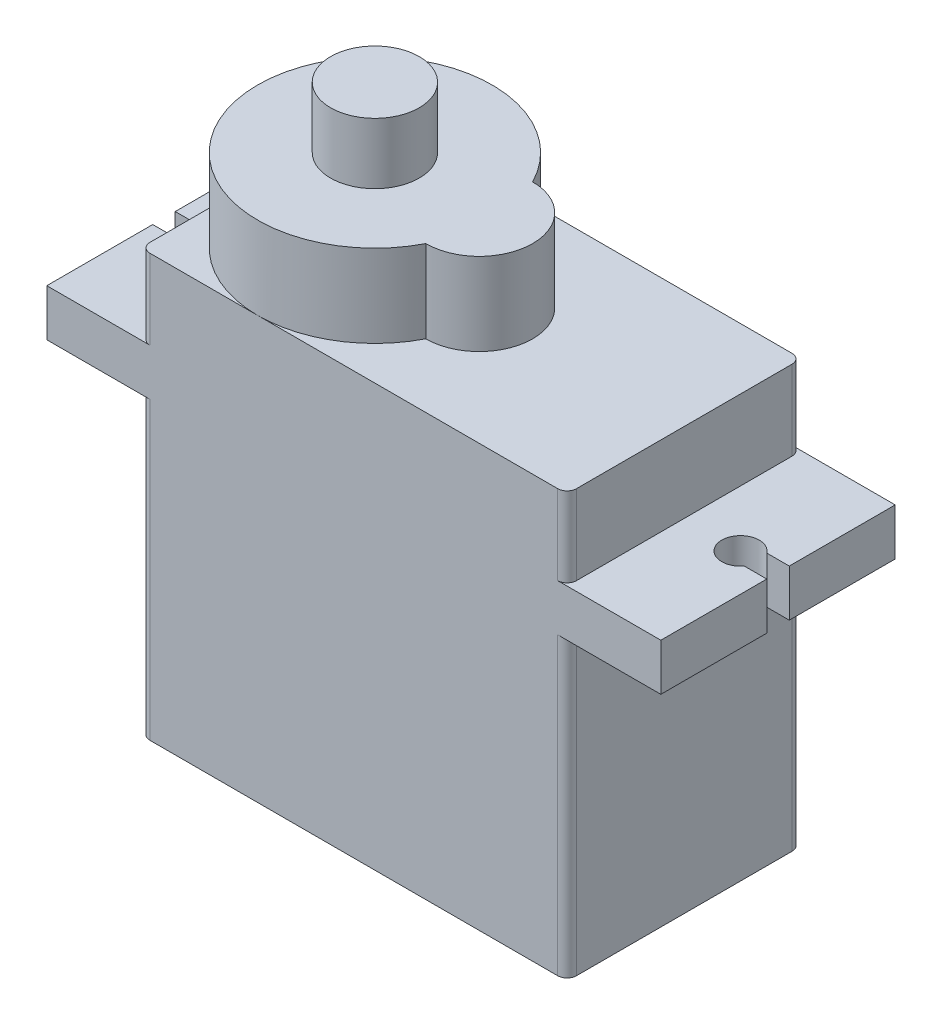
from build123d import *

# Parameters (mm, degrees)
SKETCH1_W           = 22.75
SKETCH1_H           = 12.5
BOSS_EXTRUDE1_DEPTH = 22.5
BOSS_EXTRUDE2_DEPTH = 4.4
SKETCH3_R           = 2.365
BOSS_EXTRUDE3_DEPTH = 3.25
SKETCH4_W           = 12.5
SKETCH4_H           = 2.5
BOSS_EXTRUDE4_DEPTH = 5
SKETCH5_W           = 12.5
SKETCH5_H           = 2.5
BOSS_EXTRUDE5_DEPTH = 5
CUT_EXTRUDE1_DEPTH  = 36.487673916
FILLET1_R           = 0.5


with BuildPart() as part:
    # Sketch1 → Boss-Extrude1 (new body)
    with BuildSketch(Plane(origin=(0, 0, 0), x_dir=(1, 0, 0), z_dir=(0, 1, 0))):
        with Locations((11.375, -6.25)):
            Rectangle(SKETCH1_W, SKETCH1_H)
    extrude(amount=BOSS_EXTRUDE1_DEPTH)

    # Sketch2 → Boss-Extrude2 (add)
    with BuildSketch(Plane(origin=(0, 22.5, 0), x_dir=(1, 0, 0), z_dir=(0, 1, 0))):
        with BuildLine():
            ThreePointArc((11.812373594, -3.4), (0, -6.25), (11.812373594, -9.1))
            ThreePointArc((11.812373594, -9.1), (14.662373594, -6.25), (11.812373594, -3.4))
        make_face()
    extrude(amount=BOSS_EXTRUDE2_DEPTH)

    # Sketch3 → Boss-Extrude3 (add)
    with BuildSketch(Plane(origin=(0, 26.9, 0), x_dir=(1, 0, 0), z_dir=(0, 1, 0))):
        with Locations(Location((6.25, -6.25, 0), (0, 0, 90))):
            Circle(SKETCH3_R)
    extrude(amount=BOSS_EXTRUDE3_DEPTH)

    # Sketch4 → Boss-Extrude4 (add)
    with BuildSketch(Plane(origin=(22.75, 0, 0), x_dir=(0, 0, -1), z_dir=(1, 0, 0))):
        with Locations((-6.25, 17)):
            Rectangle(SKETCH4_W, SKETCH4_H)
    extrude(amount=BOSS_EXTRUDE4_DEPTH)

    # Sketch5 → Boss-Extrude5 (add)
    with BuildSketch(Plane.ZY):
        with Locations((6.25, 17)):
            Rectangle(SKETCH5_W, SKETCH5_H)
    extrude(amount=BOSS_EXTRUDE5_DEPTH)

    # Sketch6 → Cut-Extrude1 (cut, through all)
    with BuildSketch(Plane(origin=(0, 18.25, 0), x_dir=(1, 0, 0), z_dir=(0, 1, 0))):
        with BuildLine():
            Line((27.75, -5.65), (27.75, -6.85))
            Line((27.75, -6.85), (26.55, -6.85))
            ThreePointArc((26.55, -6.85), (24.75, -6.25), (26.55, -5.65))
            Line((26.55, -5.65), (27.75, -5.65))
        make_face()
        with BuildLine():
            Line((-5, -6.85), (-5, -5.65))
            Line((-5, -5.65), (-3.8, -5.65))
            ThreePointArc((-3.8, -5.65), (-2, -6.25), (-3.8, -6.85))
            Line((-3.8, -6.85), (-5, -6.85))
        make_face()
    extrude(amount=-CUT_EXTRUDE1_DEPTH, mode=Mode.SUBTRACT)

    # Fillet1
    fillet1_edges = [part.edges().sort_by_distance(p)[0] for p in [
        (22.75, 7.875, 0),
        (22.75, 7.875, 12.5),
        (0, 7.875, 0),
        (0, 7.875, 12.5),
        (0, 20.375, 0),
        (22.75, 20.375, 0),
        (22.75, 20.375, 12.5),
        (0, 20.375, 12.5),
    ]]
    fillet(fillet1_edges, radius=FILLET1_R)


solid = part.part
